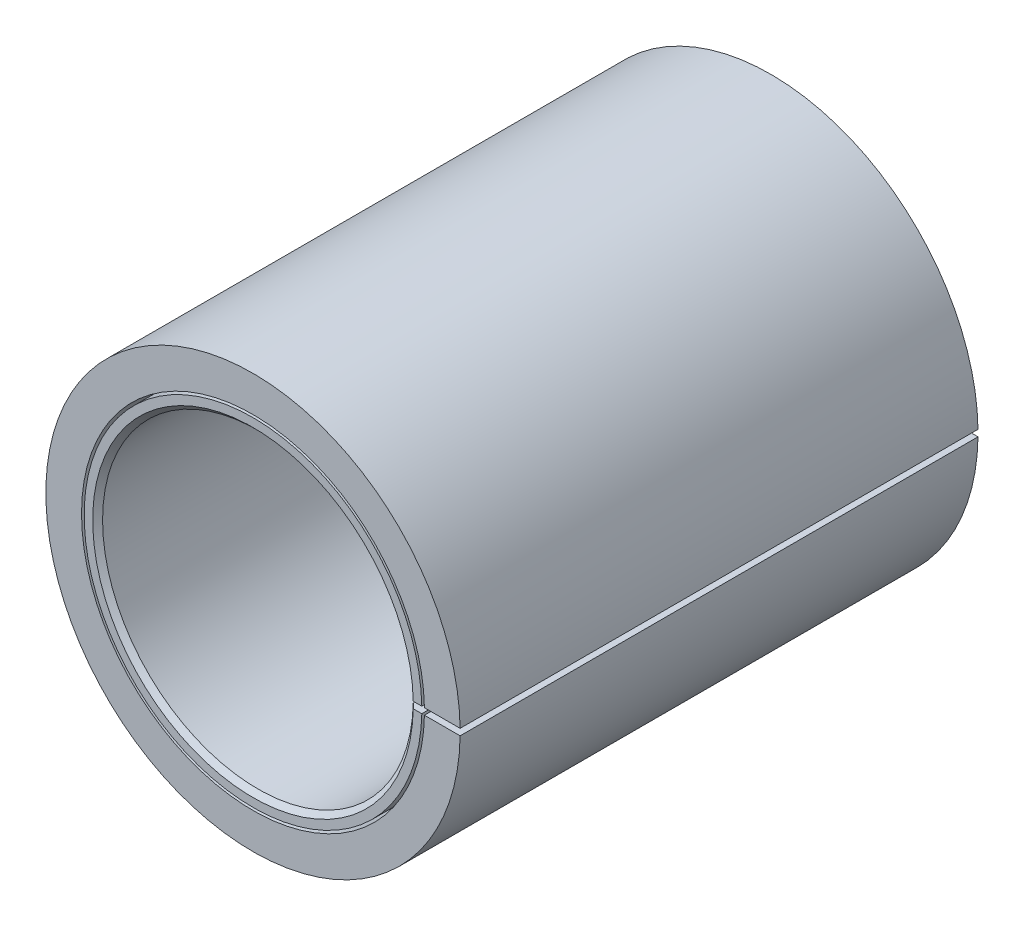
from build123d import *

# Parameters (mm, degrees)
SKETCH1_R                    = 4
SKETCH1_R_2                  = 3
BOSS_EXTRUDE1_DEPTH          = 5
CUT_EXTRUDE_THIN1_DEPTH      = 8.549834435
CUT_EXTRUDE_THIN1_DEPTH_BACK = 8.549834435
SKETCH2_R                    = 3.311114286
SKETCH2_R_2                  = 3.260314286
CHAMFER1_SIZE                = 0.095238095
SKETCH4_W                    = 4
SKETCH4_H                    = 0.125
CUT_EXTRUDE_THIN5_DEPTH      = 12.489125293


with BuildPart() as part:
    # Sketch1 → Boss-Extrude1 (new, symmetric)
    with BuildSketch(Plane.XY):
        Circle(SKETCH1_R)
        Circle(SKETCH1_R_2, mode=Mode.SUBTRACT)
    extrude(amount=BOSS_EXTRUDE1_DEPTH, both=True)

    # Sketch2 → Cut-Extrude-Thin1 (cut, two sides: drawn at the far end of the back side and taken through both)
    with BuildSketch(Plane.XY.offset(-CUT_EXTRUDE_THIN1_DEPTH_BACK)):
        Circle(SKETCH2_R)
        Circle(SKETCH2_R_2, mode=Mode.SUBTRACT)
    extrude(amount=CUT_EXTRUDE_THIN1_DEPTH + CUT_EXTRUDE_THIN1_DEPTH_BACK, mode=Mode.SUBTRACT)


with BuildPart() as cut_extrude_thin1_piece_1:
    # of the separate pieces the step leaves, piece 1, a body of its own (cut_extrude_thin1_pieces)
    add(part.part.solids().sort_by_distance((4, 0, -5))[0])


with BuildPart() as cut_extrude_thin1_piece_2:
    # of the separate pieces the step leaves, piece 2, a body of its own (cut_extrude_thin1_pieces)
    add(part.part.solids().sort_by_distance((3.260314286, 0, -5))[0])

    # Chamfer1
    chamfer1_edges = [cut_extrude_thin1_piece_2.edges().sort_by_distance(p)[0] for p in [
        (-3, 0, -5),
        (-3, 0, 5),
    ]]
    chamfer(chamfer1_edges, length=CHAMFER1_SIZE)


with BuildPart() as cut_extrude_thin5_tool:
    # Sketch4 → Cut-Extrude-Thin5 (new, through all)
    with BuildSketch(Plane.XY.offset(5)):
        with Locations((2, 0)):
            Rectangle(SKETCH4_W, SKETCH4_H)
    extrude(amount=-CUT_EXTRUDE_THIN5_DEPTH)


with BuildPart() as cut_extrude_thin1_piece_1_1:
    add(cut_extrude_thin1_piece_1.part)

    # Cut-Extrude-Thin5: cut by cut_extrude_thin5_tool
    add(cut_extrude_thin5_tool.part, mode=Mode.SUBTRACT)


with BuildPart() as cut_extrude_thin1_piece_2_1:
    add(cut_extrude_thin1_piece_2.part)

    # Cut-Extrude-Thin5: cut by cut_extrude_thin5_tool
    add(cut_extrude_thin5_tool.part, mode=Mode.SUBTRACT)


solid = Compound([cut_extrude_thin1_piece_1_1.part, cut_extrude_thin1_piece_2_1.part])
